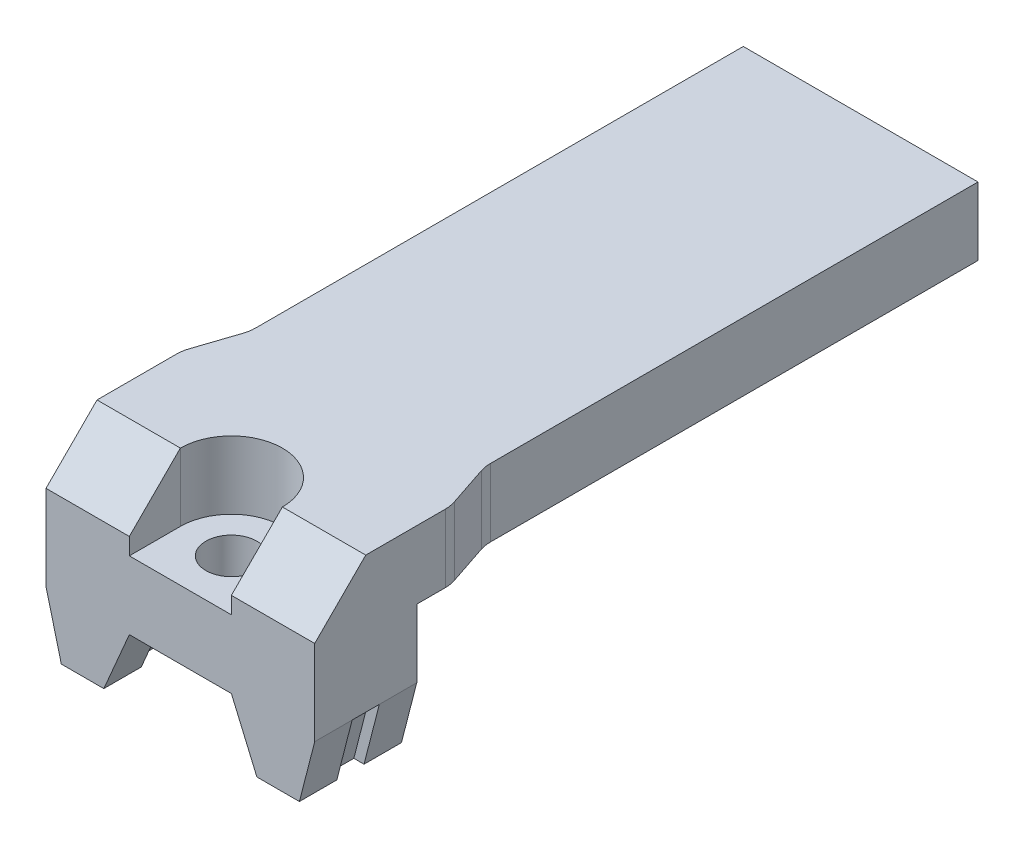
from build123d import *
from build123d.topology import SkipClean

# Parameters (mm, degrees)
EXTRUDE_1_DEPTH     = 4
EXTRUDE_3_DEPTH     = 6
CHAMFER_1_SIZE      = 3
CUT_EXTRUDE_2_DEPTH = 3.99
CUT_EXTRUDE_3_REACH = 51.222
SKETCH_7_R          = 1.5
SKETCH_8_R          = 6
EXTRUDE_4_DEPTH     = 1
FILLET_1_R          = 0.5
SKETCH_9_R          = 5
CUT_EXTRUDE_4_DEPTH = 3
SKETCH_10_R         = 3.55
CUT_EXTRUDE_5_DEPTH = 3.6
CUT_EXTRUDE_6_DEPTH = 0.8
CUT_EXTRUDE_7_DEPTH = 50.986598204
FILLET_2_R          = 2


with BuildPart() as part:
    # ｽｹｯﾁ1 → ﾎﾞｽ - 押し出し1 (new body)
    with BuildSketch(Plane(origin=(0, 0, 0), x_dir=(1, 0, 0), z_dir=(0, 1, 0))):
        with BuildLine():
            Line((-7.9, 0), (-7.9, -48))
            Line((-7.9, -48), (7.9, -48))
            Line((7.9, -48), (7.9, 0))
            ThreePointArc((7.9, 0), (0, 7.9), (-7.9, 0))
        make_face()
    extrude(amount=EXTRUDE_1_DEPTH)

    # ｽｹｯﾁ4 → ﾎﾞｽ - 押し出し3 (add)
    with BuildSketch(Plane.XY.offset(48)):
        Polygon((-7, -7.5), (-4.5, -7.5), (-3, -4), (3, -4), (4.5, -7.5), (7, -7.5), (7.9, -4), (7.9, 0), (-7.9, 0), (-7.9, -4), align=None)
    extrude(amount=-EXTRUDE_3_DEPTH)

    # 面取り1
    chamfer_1_edges = [part.edges().sort_by_distance(p)[0] for p in [
        (0, 4, 48),
    ]]
    chamfer(chamfer_1_edges, length=CHAMFER_1_SIZE)

    # ｽｹｯﾁ6 → ｶｯﾄ - 押し出し2 (cut)
    with BuildSketch(Plane(origin=(0, 4, 0), x_dir=(1, 0, 0), z_dir=(0, 1, 0))):
        with BuildLine():
            Line((-3, -45), (-3, -49))
            Line((-3, -49), (3, -49))
            Line((3, -49), (3, -45))
            ThreePointArc((3, -45), (0, -42), (-3, -45))
        make_face()
    extrude(amount=-CUT_EXTRUDE_2_DEPTH, mode=Mode.SUBTRACT)

    # ｽｹｯﾁ7 → ｶｯﾄ - 押し出し3 (cut, up to next)
    with BuildSketch(Plane(origin=(0, 0.01, 0), x_dir=(1, 0, 0), z_dir=(0, 1, 0)), mode=Mode.PRIVATE) as cut_extrude_3_sk1:
        with Locations(Location((0, -45, 0), (0, 0, 270))):
            Circle(SKETCH_7_R)
    cut_extrude_3_tool1 = extrude(cut_extrude_3_sk1.sketch, amount=-CUT_EXTRUDE_3_REACH, mode=Mode.PRIVATE) & part.part
    add(cut_extrude_3_tool1.solids().sort_by_distance((0, 0.01, 45))[0], mode=Mode.SUBTRACT)

    # ｽｹｯﾁ8 → ﾎﾞｽ - 押し出し4 (add)
    with BuildSketch(Plane.XZ):
        with Locations(Location((0, 0, 0), (0, 0, 90))):
            Circle(SKETCH_8_R)
    extrude(amount=EXTRUDE_4_DEPTH)

    # ﾌｨﾚｯﾄ1
    fillet_1_edges = [part.edges().sort_by_distance(p)[0] for p in [
        (0, 0, -6),
    ]]
    fillet(fillet_1_edges, radius=FILLET_1_R)

    # ｽｹｯﾁ9 → ｶｯﾄ - 押し出し4 (cut)
    with BuildSketch(Plane(origin=(0, 4, 0), x_dir=(1, 0, 0), z_dir=(0, 1, 0))):
        with Locations(Location((0, 0, 0), (0, 0, 270))):
            Circle(SKETCH_9_R)
    extrude(amount=-CUT_EXTRUDE_4_DEPTH, mode=Mode.SUBTRACT)

    # ｽｹｯﾁ10 → ｶｯﾄ - 押し出し5 (cut)
    with BuildSketch(Plane(origin=(0, 1, 0), x_dir=(1, 0, 0), z_dir=(0, 1, 0))):
        with Locations(Location((0, 0, 0), (0, 0, 270))):
            Circle(SKETCH_10_R)
    extrude(amount=-CUT_EXTRUDE_5_DEPTH, mode=Mode.SUBTRACT)

    # ｽｹｯﾁ11 → ｶｯﾄ - 押し出し6 (cut, symmetric)
    with BuildSketch(Plane.XY.offset(45)):
        Polygon((3, -4), (4.5, -7.5), (5.1, -7.5), (3.6, -4), align=None)
        Polygon((6.4, -7.5), (7, -7.5), (7.9, -4), (7.3, -4), align=None)
    cut_extrude_6 = extrude(amount=CUT_EXTRUDE_6_DEPTH, both=True, mode=Mode.SUBTRACT)

    # ﾐﾗｰ1: ｶｯﾄ - 押し出し6 across plane
    add(cut_extrude_6.mirror(Plane(origin=(0, 0, 0), x_dir=(0, 0, 1), z_dir=(1, 0, 0))), mode=Mode.SUBTRACT)

    # ｽｹｯﾁ12 → ｶｯﾄ - 押し出し7 (cut, through all)
    with SkipClean():  # the faces are left unmerged after this step: merging them gives an invalid solid
        with BuildSketch(Plane(origin=(0, 4, 0), x_dir=(1, 0, 0), z_dir=(0, 1, 0))):
            with BuildLine():
                Line((-7.9, 0), (-7.9, -40))
                Line((-7.9, -40), (-6.9, -37))
                Line((-6.9, -37), (-6.9, -3.847076812))
                ThreePointArc((-6.9, -3.847076812), (-7.645913941, -1.987460691), (-7.9, 0))
            make_face()
        cut_extrude_7 = extrude(amount=-CUT_EXTRUDE_7_DEPTH, mode=Mode.SUBTRACT)

    # ﾐﾗｰ2: ｶｯﾄ - 押し出し7 across plane
    with SkipClean():  # the faces are left unmerged after this step: merging them gives an invalid solid
        add(cut_extrude_7.mirror(Plane(origin=(0, 0, 0), x_dir=(0, 0, 1), z_dir=(1, 0, 0))), mode=Mode.SUBTRACT)

    # ﾌｨﾚｯﾄ2
    fillet_2_edges = [part.edges().sort_by_distance(p)[0] for p in [
        (-6.9, 2, 3.847076812),
        (-6.9, 2, 37),
        (-7.9, 2, 40),
        (6.9, 2, 3.847076812),
        (7.9, 2, 40),
        (6.9, 2, 37),
    ]]
    fillet(fillet_2_edges, radius=FILLET_2_R)

    # Surface Cut 1
    split(bisect_by=Plane.XY.offset(8), keep=Keep.TOP)


solid = part.part
